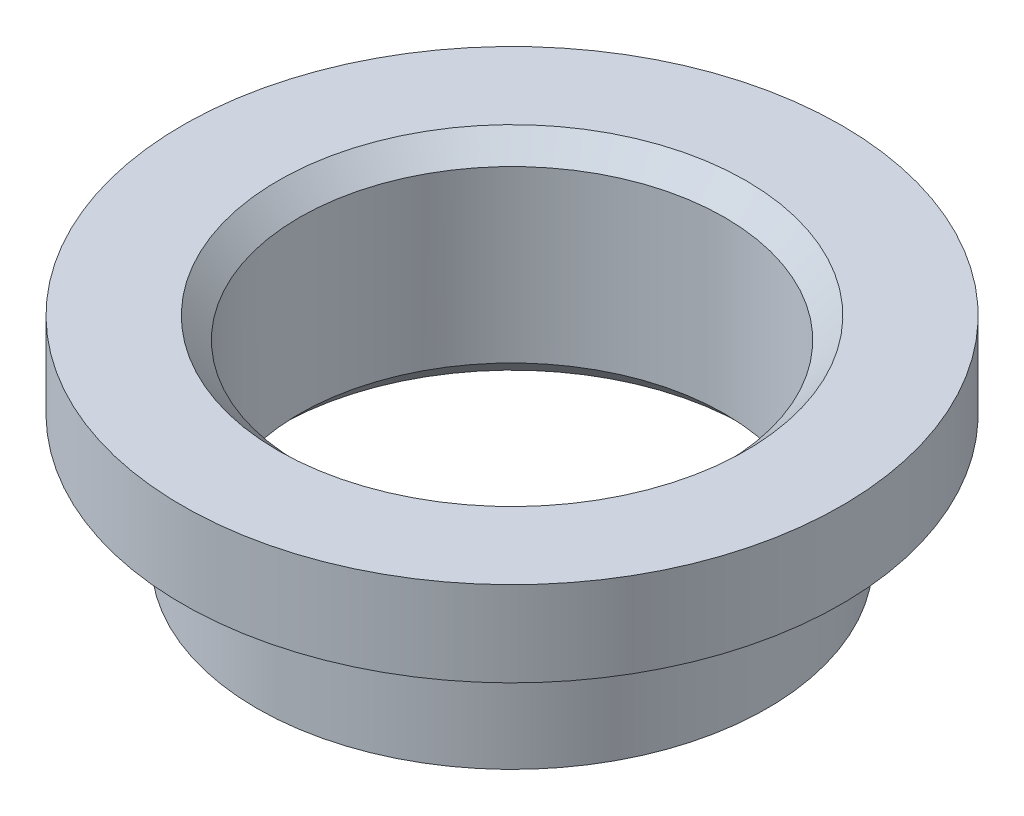
from build123d import *

# Parameters (mm, degrees)
CHAMFER1_SIZE = 0.5


with BuildPart() as part:
    # Sketch1 → Revolve1 (revolve)
    with BuildSketch(Plane.XY, mode=Mode.PRIVATE) as revolve1_sk:
        Polygon((5, 0), (5, -5), (6, -5), (6, -2), (7.75, -2), (7.75, 0), align=None)
    revolve(revolve1_sk.sketch.rotate(Axis((0, 0, 0), (0, 1, 0)), 90), axis=Axis((0, 0, 0), (0, 1, 0)))

    # Chamfer1
    chamfer1_edges = [part.edges().sort_by_distance(p)[0] for p in [
        (0, 0, 5),
        (0, -5, 5),
    ]]
    chamfer(chamfer1_edges, length=CHAMFER1_SIZE)


solid = part.part
